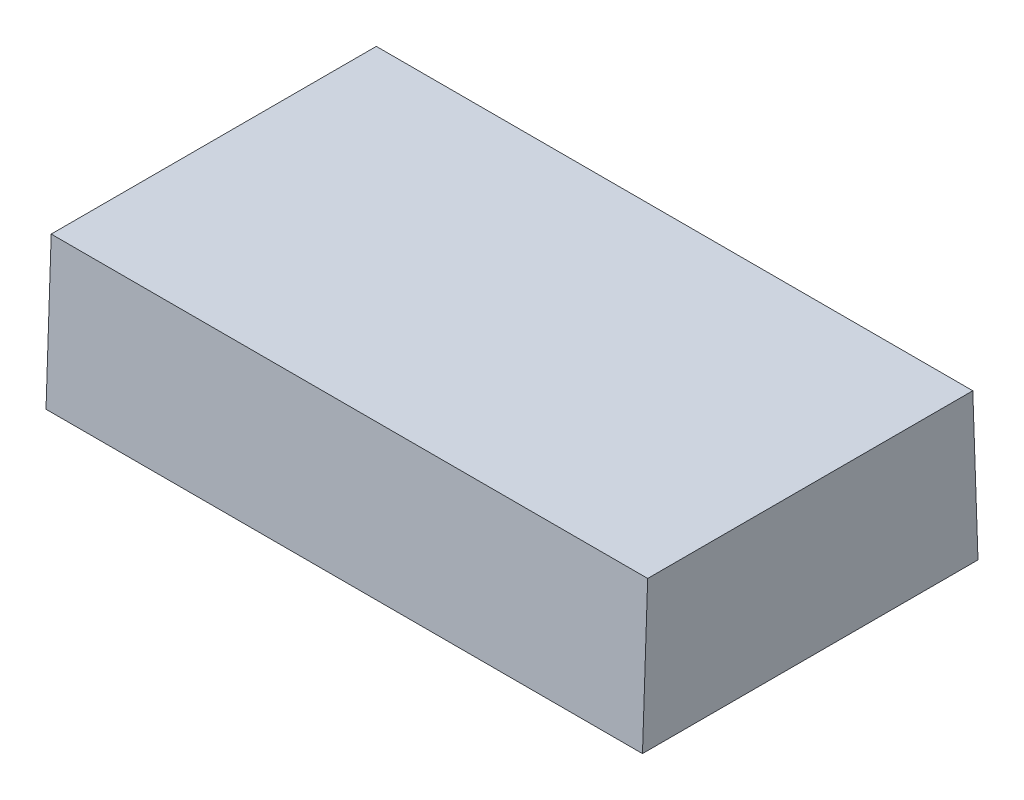
from build123d import *

# Parameters (mm, degrees)
BOSS_EXTRUDE5_DEPTH = 203.2
CUT_EXTRUDE3_START  = 9.525
CUT_EXTRUDE3_DEPTH  = 182.88


with BuildPart() as part:
    # Sketch6 → Boss-Extrude5 (new body)
    with BuildSketch(Plane(origin=(0, 0, 0), x_dir=(0, 0, -1), z_dir=(1, 0, 0))):
        Polygon((0, 0), (114.3, 0), (112.52602491, 50.8), (1.77397509, 50.8), align=None)
    extrude(amount=BOSS_EXTRUDE5_DEPTH)

    # Sketch9 → Cut-Extrude3 (cut)
    with BuildSketch(Plane(origin=(0, 0, 0), x_dir=(0, 0, -1), z_dir=(1, 0, 0)).offset(CUT_EXTRUDE3_START)):
        Polygon((103.847668826, 9.525), (102.738934394, 41.275), (10.97216067, 41.275), (9.863426239, 9.525), align=None)
    extrude(amount=CUT_EXTRUDE3_DEPTH, mode=Mode.SUBTRACT)


solid = part.part
